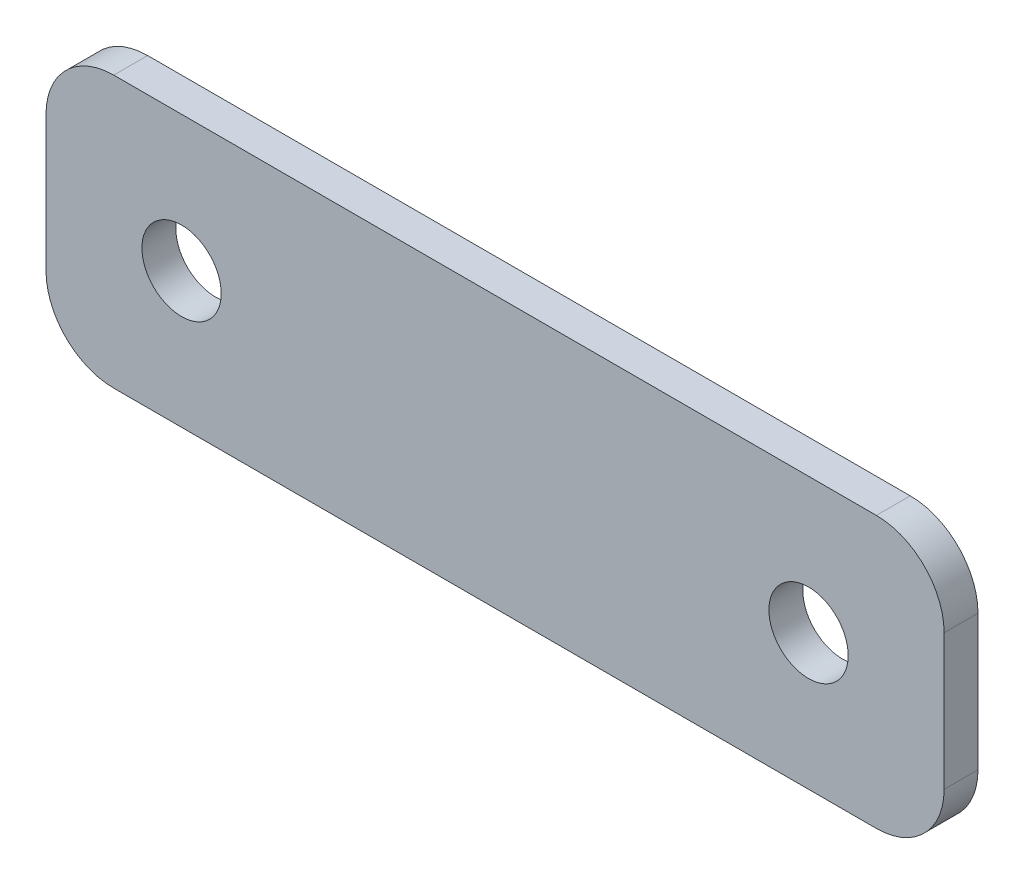
from build123d import *

# Parameters (mm, degrees)
SKETCH1_R           = 2.9718
BOSS_EXTRUDE1_DEPTH = 2.54


with BuildPart() as part:
    # Sketch1 → Boss-Extrude1 (new body)
    with BuildSketch(Plane.XY):
        with BuildLine():
            Line((-46.99, 10.16), (0, 10.16))
            Line((0, 10.16), (5.08, 10.16))
            ThreePointArc((5.08, 10.16), (8.672102448, 8.672102448), (10.16, 5.08))
            Line((10.16, 5.08), (10.16, 0))
            Line((10.16, 0), (10.16, -5.08))
            ThreePointArc((10.16, -5.08), (8.672102448, -8.672102448), (5.08, -10.16))
            Line((5.08, -10.16), (-46.99, -10.16))
            Line((-46.99, -10.16), (-52.07, -10.16))
            ThreePointArc((-52.07, -10.16), (-55.662102448, -8.672102448), (-57.15, -5.08))
            Line((-57.15, -5.08), (-57.15, 5.08))
            ThreePointArc((-57.15, 5.08), (-55.662102448, 8.672102448), (-52.07, 10.16))
            Line((-52.07, 10.16), (-46.99, 10.16))
        make_face()
        Circle(SKETCH1_R, mode=Mode.SUBTRACT)
        with Locations((-46.99, 0)):
            Circle(SKETCH1_R, mode=Mode.SUBTRACT)
    extrude(amount=BOSS_EXTRUDE1_DEPTH)


solid = part.part
